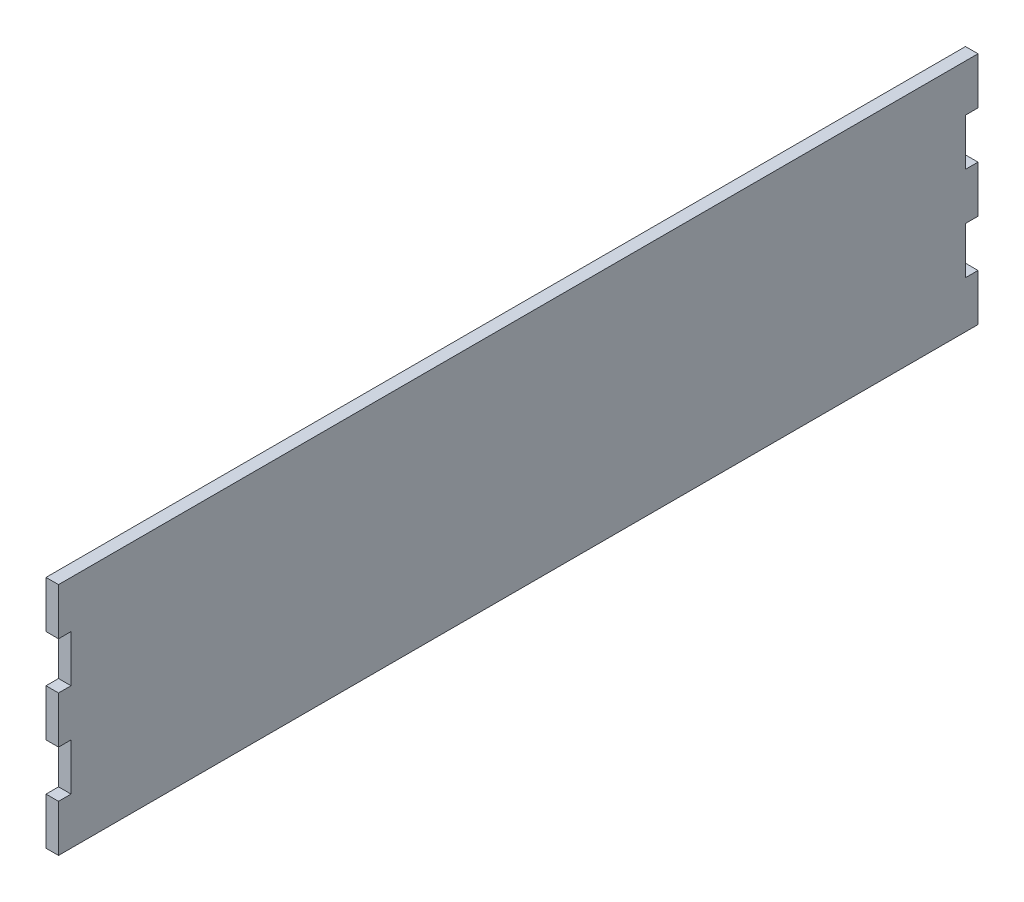
from build123d import *

# Parameters (mm, degrees)
BOSS_EXTRUDE1_DEPTH = 4


with BuildPart() as part:
    # Sketch1 → Boss-Extrude1 (new body)
    with BuildSketch(Plane(origin=(0, 0, 0), x_dir=(0, 0, -1), z_dir=(1, 0, 0))):
        Polygon((-147, 37.251830895), (147, 37.251830895), (147, 22.251830895), (143, 22.251830895), (143, 7.251830895), (147, 7.251830895), (147, -7.748169105), (143, -7.748169105), (143, -22.748169105), (147, -22.748169105), (147, -37.748169105), (-147, -37.748169105), (-147, -22.748169105), (-143, -22.748169105), (-143, -7.748169105), (-147, -7.748169105), (-147, 7.251830895), (-143, 7.251830895), (-143, 22.251830895), (-147, 22.251830895), align=None)
    extrude(amount=BOSS_EXTRUDE1_DEPTH)


solid = part.part
